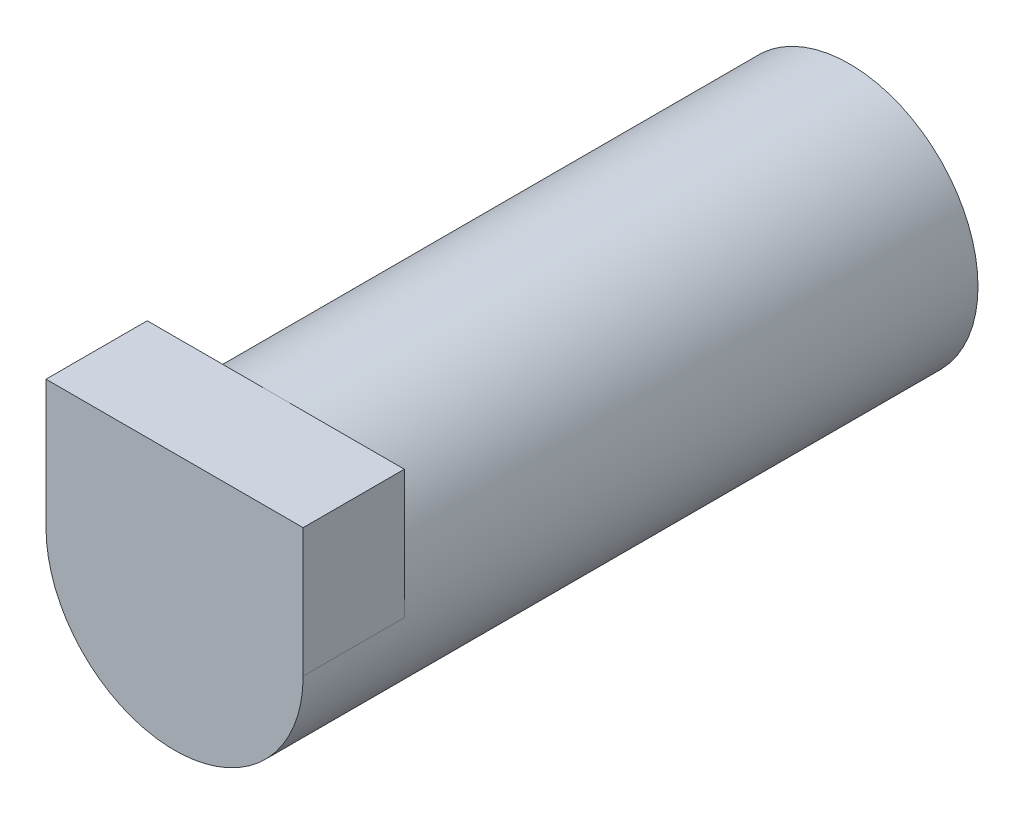
from build123d import *

# Parameters (mm, degrees)
CROQUIS1_R              = 19.05
SALIENTE_EXTRUIR1_DEPTH = 100
SALIENTE_EXTRUIR2_START = -15
SALIENTE_EXTRUIR2_DEPTH = 15


with BuildPart() as part:
    # Croquis1 → Saliente-Extruir1 (new body)
    with BuildSketch(Plane.XY):
        Circle(CROQUIS1_R)
    extrude(amount=SALIENTE_EXTRUIR1_DEPTH)

    # Croquis2 → Saliente-Extruir2 (add)
    with BuildSketch(Plane.XY.offset(100).offset(SALIENTE_EXTRUIR2_START)):
        with BuildLine():
            Line((19.05, 19.05), (0, 19.05))
            ThreePointArc((0, 19.05), (13.470384182, 13.470384182), (19.05, 0))
            Line((19.05, 0), (19.05, 19.05))
        make_face()
        with BuildLine():
            ThreePointArc((-19.05, 0), (-13.470384182, 13.470384182), (0, 19.05))
            Line((0, 19.05), (-19.05, 19.05))
            Line((-19.05, 19.05), (-19.05, 0))
        make_face()
    extrude(amount=SALIENTE_EXTRUIR2_DEPTH)


solid = part.part
